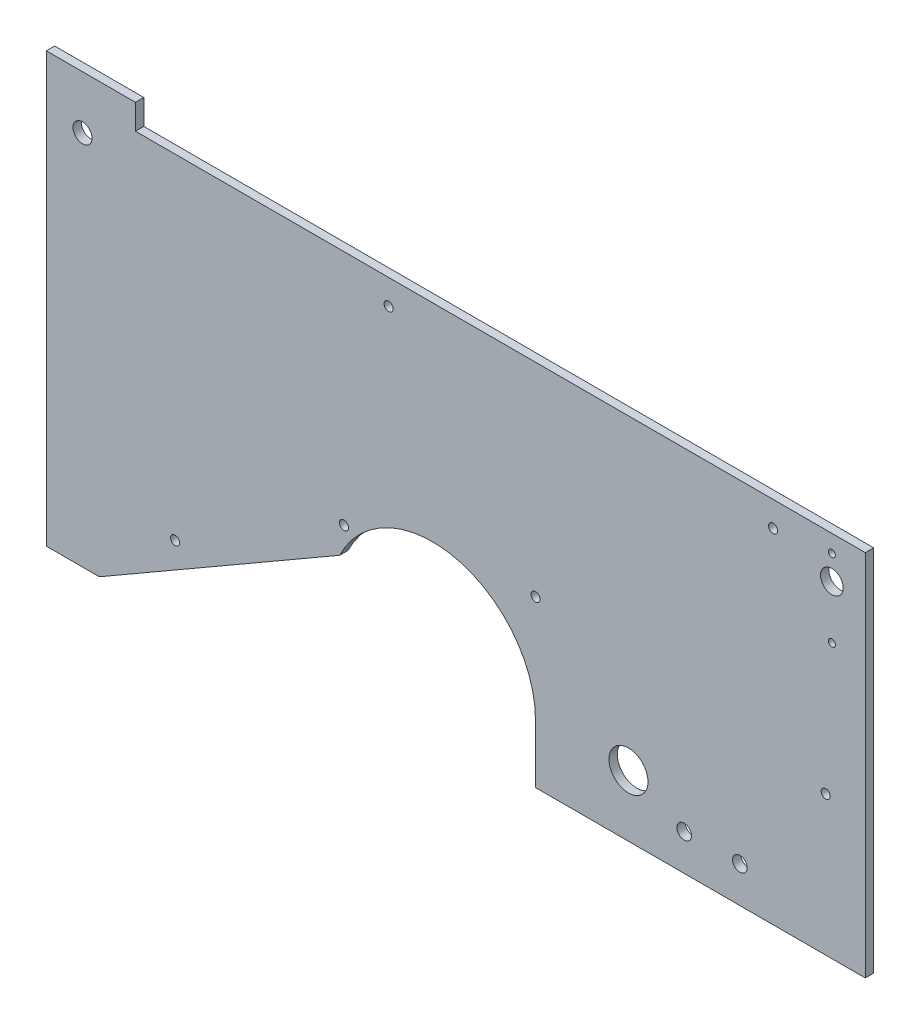
from build123d import *

# Parameters (mm, degrees)
SKETCH2_R           = 3.425
BOSS_EXTRUDE2_DEPTH = 3
SKETCH3_W           = 118.4
SKETCH3_H           = 12.75
CUT_EXTRUDE1_DEPTH  = 338.231374578
SKETCH5_R           = 2.625
SKETCH5_R_2         = 4.075
SKETCH5_R_3         = 1.25
SKETCH5_R_4         = 1.625
SKETCH5_R_5         = 7
SKETCH5_W           = 6
SKETCH5_H           = 154
CUT_EXTRUDE2_DEPTH  = 338.231374578


with BuildPart() as part:
    # Sketch2 → Boss-Extrude2 (new body)
    with BuildSketch(Plane.XY):
        with BuildLine():
            Line((25.03035901, 0), (111.286489227, 49.8))
            ThreePointArc((111.286489227, 49.8), (152.858332199, 69.766604349), (181.6, 33.7))
            Line((181.6, 33.7), (181.6, 0))
            Line((181.6, 0), (300, 0))
            Line((300, 0), (300, 145))
            Line((300, 145), (38, 145))
            Line((38, 145), (38, 154))
            Line((38, 154), (19, 154))
            Line((19, 154), (0, 154))
            Line((0, 154), (0, 0))
            Line((0, 0), (25.03035901, 0))
        make_face()
        with Locations((19, 135)):
            Circle(SKETCH2_R, mode=Mode.SUBTRACT)
    extrude(amount=BOSS_EXTRUDE2_DEPTH)

    # Sketch3 → Cut-Extrude1 (cut, through all)
    with BuildSketch(Plane.XY.offset(3)):
        with Locations((240.8, 6.375)):
            Rectangle(SKETCH3_W, SKETCH3_H)
    extrude(amount=-CUT_EXTRUDE1_DEPTH, mode=Mode.SUBTRACT)

    # Sketch5 → Cut-Extrude2 (cut, through all)
    with BuildSketch(Plane.XY.offset(3)):
        with Locations((254.98, 25.75)):
            Circle(SKETCH5_R)
        with Locations((234.98, 25.75)):
            Circle(SKETCH5_R)
        with Locations((288, 130)):
            Circle(SKETCH5_R_2)
        with Locations((288, 138.75)):
            Circle(SKETCH5_R_3)
        with Locations((288, 110.95)):
            Circle(SKETCH5_R_3)
        with Locations((181.6, 72.03)):
            Circle(SKETCH5_R_4)
        with Locations((285.78, 62.92)):
            Circle(SKETCH5_R_4)
        with Locations((52.23, 24.91)):
            Circle(SKETCH5_R_4)
        with Locations((112.84, 59.93)):
            Circle(SKETCH5_R_4)
        with Locations((266.89, 135.99)):
            Circle(SKETCH5_R_4)
        with Locations((128.89, 135.99)):
            Circle(SKETCH5_R_4)
        with Locations((214.98, 34.75)):
            Circle(SKETCH5_R_5)
        with Locations((3, 77)):
            Rectangle(SKETCH5_W, SKETCH5_H)
    extrude(amount=-CUT_EXTRUDE2_DEPTH, mode=Mode.SUBTRACT)


solid = part.part
